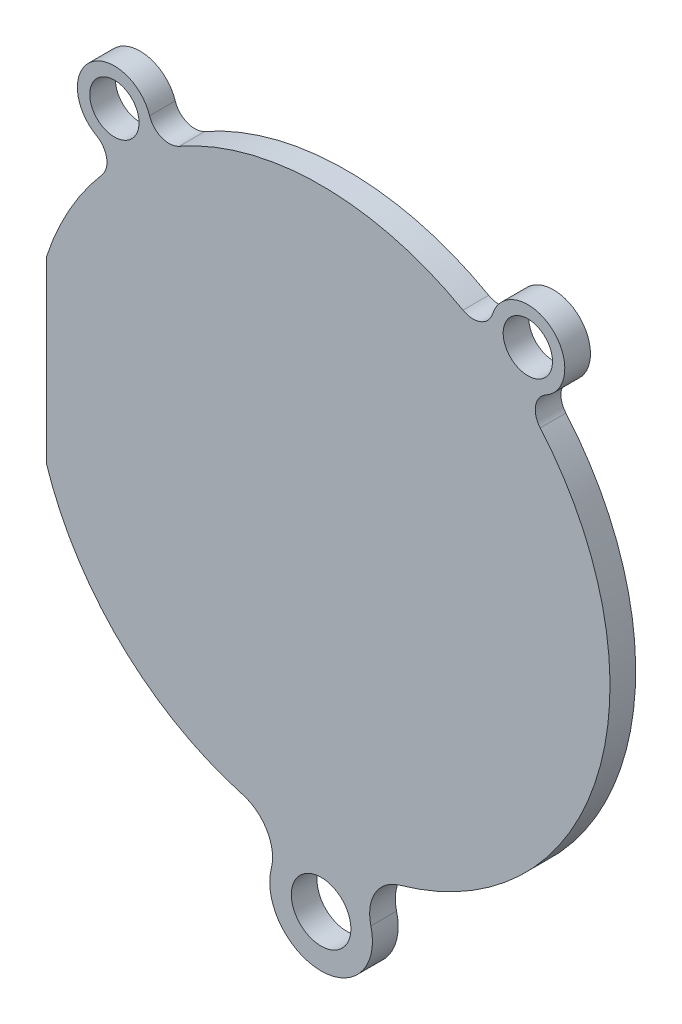
from build123d import *

# Parameters (mm, degrees)
SKETCH1_R           = 1.8415
SKETCH1_R_2         = 1.524
BOSS_EXTRUDE1_DEPTH = 1.5875


with BuildPart() as part:
    # Sketch1 → Boss-Extrude1 (new body)
    with BuildSketch(Plane.XY):
        with BuildLine():
            Line((-16.984058744, -5.5245), (-16.984058744, 5.5245))
            ThreePointArc((-16.984058744, 5.5245), (-15.568317368, 8.752476564), (-13.546192494, 11.63954555))
            ThreePointArc((-13.546192494, 11.63954555), (-13.259158261, 12.690113591), (-13.891550513, 13.576771304))
            ThreePointArc((-13.891550513, 13.576771304), (-14.229434947, 17.341171737), (-10.60343846, 16.274857526))
            ThreePointArc((-10.60343846, 16.274857526), (-9.857305878, 15.481530337), (-8.770915553, 15.557936625))
            ThreePointArc((-8.770915553, 15.557936625), (0, 17.859965052), (8.770915553, 15.557936625))
            ThreePointArc((8.770915553, 15.557936625), (9.857305878, 15.481530337), (10.60343846, 16.274857526))
            ThreePointArc((10.60343846, 16.274857526), (14.229434947, 17.341171737), (13.891550513, 13.576771304))
            ThreePointArc((13.891550513, 13.576771304), (13.259158261, 12.690113591), (13.546192494, 11.63954555))
            ThreePointArc((13.546192494, 11.63954555), (17.099028169, -5.157672667), (4.850582957, -17.188664772))
            ThreePointArc((4.850582957, -17.188664772), (3.34119056, -18.362373067), (3.078011585, -20.256203417))
            ThreePointArc((3.078011585, -20.256203417), (0, -24.209965052), (-3.078011585, -20.256203417))
            ThreePointArc((-3.078011585, -20.256203417), (-3.34119056, -18.362373067), (-4.850582957, -17.188664772))
            ThreePointArc((-4.850582957, -17.188664772), (-12.377442365, -12.875452309), (-16.984058744, -5.5245))
        make_face()
        with Locations((0, -21.034965052)):
            Circle(SKETCH1_R, mode=Mode.SUBTRACT)
        with Locations((-12.779339593, 15.573965052)):
            Circle(SKETCH1_R_2, mode=Mode.SUBTRACT)
        with Locations((12.779339593, 15.573965052)):
            Circle(SKETCH1_R_2, mode=Mode.SUBTRACT)
    extrude(amount=BOSS_EXTRUDE1_DEPTH)


solid = part.part
